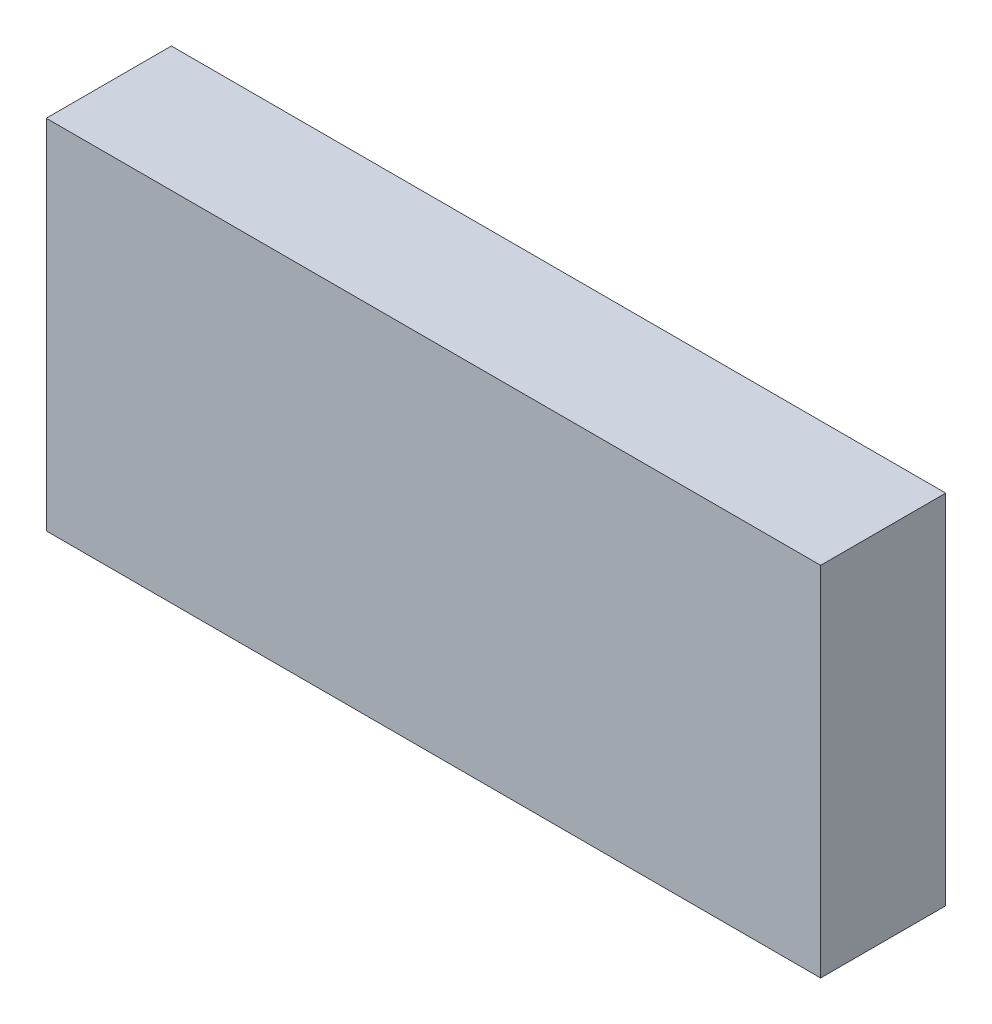
from build123d import *

# Parameters (mm, degrees)
SKETCH1_W           = 130
SKETCH1_H           = 60
BOSS_EXTRUDE1_DEPTH = 21


with BuildPart() as part:
    # Sketch1 → Boss-Extrude1 (new body)
    with BuildSketch(Plane.XY):
        Rectangle(SKETCH1_W, SKETCH1_H)
    extrude(amount=BOSS_EXTRUDE1_DEPTH)


solid = part.part
